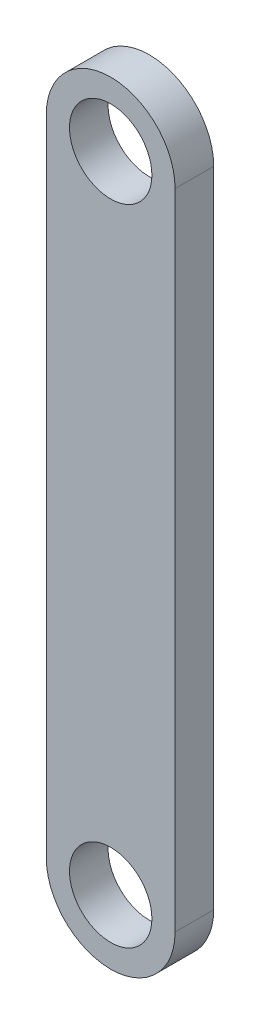
from build123d import *

# Parameters (mm, degrees)
ESQUISSE2_R        = 6.4
BOSS_EXTRU_1_DEPTH = 6


with BuildPart() as part:
    # Esquisse2 → Boss.-Extru.1 (new body)
    with BuildSketch(Plane.XY):
        with BuildLine():
            Line((0, 0), (0, 100))
            ThreePointArc((0, 100), (10, 110), (20, 100))
            Line((20, 100), (20, 0))
            ThreePointArc((20, 0), (10, -10), (0, 0))
        make_face()
        with Locations((10, 100)):
            Circle(ESQUISSE2_R, mode=Mode.SUBTRACT)
        with Locations((10, 0)):
            Circle(ESQUISSE2_R, mode=Mode.SUBTRACT)
    extrude(amount=BOSS_EXTRU_1_DEPTH)


solid = part.part
